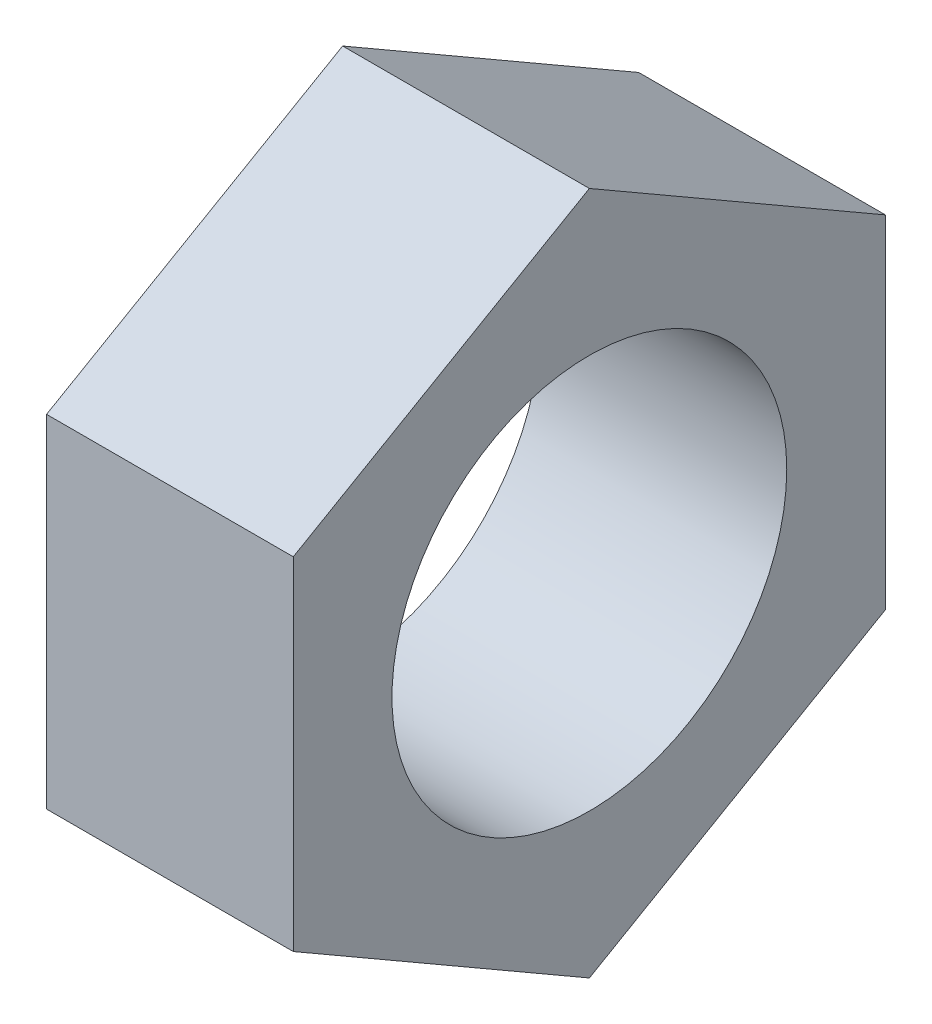
from build123d import *

# Parameters (mm, degrees)
EXTRUDE_1_DEPTH = 5


with BuildPart() as part:
    # 草图1 → 凸台-拉伸1 (new body)
    # profile 1 of 7: a face of its own
    with BuildSketch(Plane(origin=(0, 0, 0), x_dir=(0, 0, -1), z_dir=(1, 0, 0))):
        Polygon((6, -3.464101615), (6, 3.464101615), (0, 6.92820323), (-6, 3.464101615), (-6, -3.464101615), (0, -6.92820323), align=None)
        Polygon((0, -4.618802154), (4, -2.309401077), (4, 2.309401077), (0, 4.618802154), (-4, 2.309401077), (-4, -2.309401077), align=None, mode=Mode.SUBTRACT)
    # profile 2 of 7: a face of its own
    with BuildSketch(Plane(origin=(0, 0, 0), x_dir=(0, 0, -1), z_dir=(1, 0, 0))):
        with BuildLine():
            ThreePointArc((-4, 0), (-3.464101617, 1.999999997), (-2.000000006, 3.464101612))
            Line((-2.000000006, 3.464101612), (-4, 2.309401077))
            Line((-4, 2.309401077), (-4, 0))
        make_face()
    # profile 3 of 7: a face of its own
    with BuildSketch(Plane(origin=(0, 0, 0), x_dir=(0, 0, -1), z_dir=(1, 0, 0))):
        with BuildLine():
            Line((-4, -2.309401077), (-2.000000006, -3.464101612))
            ThreePointArc((-2.000000006, -3.464101612), (-3.464101617, -1.999999997), (-4, 0))
            Line((-4, 0), (-4, -2.309401077))
        make_face()
    # profile 4 of 7: a face of its own
    with BuildSketch(Plane(origin=(0, 0, 0), x_dir=(0, 0, -1), z_dir=(1, 0, 0))):
        with BuildLine():
            Line((0, -4.618802154), (2.000000006, -3.464101612))
            ThreePointArc((2.000000006, -3.464101612), (0, -4), (-2.000000006, -3.464101612))
            Line((-2.000000006, -3.464101612), (0, -4.618802154))
        make_face()
    # profile 5 of 7: a face of its own
    with BuildSketch(Plane(origin=(0, 0, 0), x_dir=(0, 0, -1), z_dir=(1, 0, 0))):
        with BuildLine():
            Line((2.000000006, -3.464101612), (4, -2.309401077))
            Line((4, -2.309401077), (4, 0))
            ThreePointArc((4, 0), (3.464101617, -1.999999997), (2.000000006, -3.464101612))
        make_face()
    # profile 6 of 7: a face of its own
    with BuildSketch(Plane(origin=(0, 0, 0), x_dir=(0, 0, -1), z_dir=(1, 0, 0))):
        with BuildLine():
            ThreePointArc((2.000000034, 3.464101596), (3.464101625, 1.999999983), (4, 0))
            Line((4, 0), (4, 2.309401077))
            Line((4, 2.309401077), (2.000000034, 3.464101596))
        make_face()
    # profile 7 of 7: a face of its own
    with BuildSketch(Plane(origin=(0, 0, 0), x_dir=(0, 0, -1), z_dir=(1, 0, 0))):
        with BuildLine():
            ThreePointArc((-2.000000006, 3.464101612), (1.6e-08, 4), (2.000000034, 3.464101596))
            Line((2.000000034, 3.464101596), (0, 4.618802154))
            Line((0, 4.618802154), (-2.000000006, 3.464101612))
        make_face()
    extrude(amount=EXTRUDE_1_DEPTH)


solid = part.part
